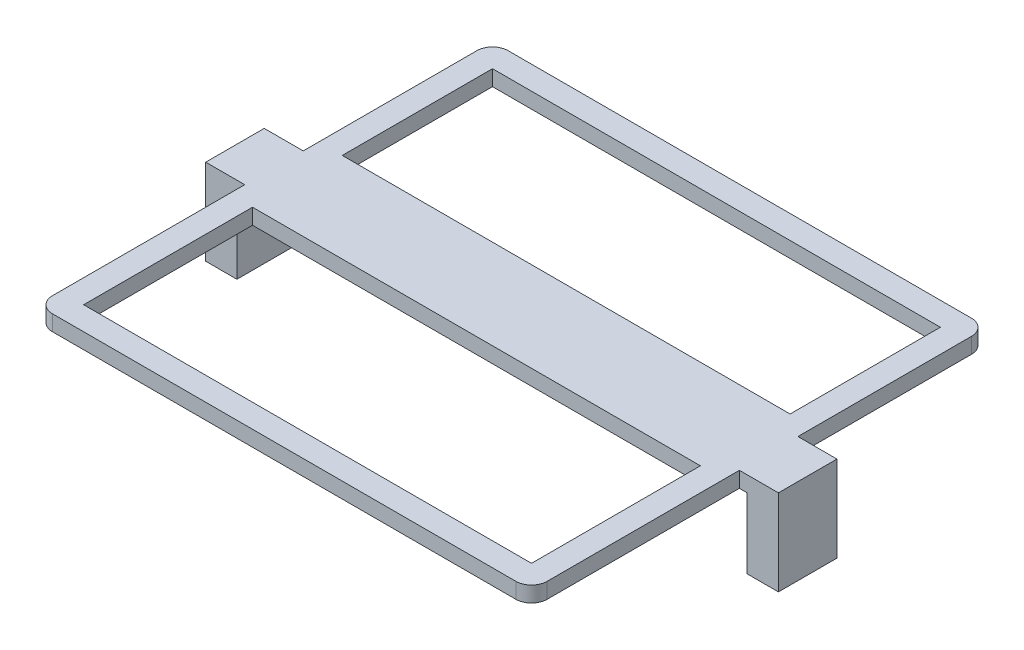
from build123d import *

# Parameters (mm, degrees)
SKETCH_1_W      = 57.4
SKETCH_1_H      = 19.255
SKETCH_1_H_2    = 21.645
EXTRUDE_1_DEPTH = 2
FILLET_1_R      = 2
SKETCH_2_W      = 4
SKETCH_2_H      = 7.5
EXTRUDE_2_DEPTH = 9


with BuildPart() as part:
    # Эскиз1 → Бобышка-Вытянуть1 (new body)
    with BuildSketch(Plane(origin=(0, 0, 0), x_dir=(1, 0, 0), z_dir=(0, 1, 0))):
        Polygon((63.4, -24.255), (68.4, -24.255), (68.4, -31.755), (63.4, -31.755), (63.4, -58.4), (0, -58.4), (0, -31.755), (-5, -31.755), (-5, -24.255), (0, -24.255), (0, 0), (63.4, 0), align=None)
        with Locations((31.7, -12.6275)):
            Rectangle(SKETCH_1_W, SKETCH_1_H, mode=Mode.SUBTRACT)
        with Locations((31.7, -44.5775)):
            Rectangle(SKETCH_1_W, SKETCH_1_H_2, mode=Mode.SUBTRACT)
    extrude(amount=EXTRUDE_1_DEPTH)

    # Скругление1
    fillet_1_edges = [part.edges().sort_by_distance(p)[0] for p in [
        (0, 1, 0),
        (63.4, 1, 0),
        (63.4, 1, 58.4),
        (0, 1, 58.4),
    ]]
    fillet(fillet_1_edges, radius=FILLET_1_R)

    # Эскиз2 → Бобышка-Вытянуть2 (add)
    with BuildSketch(Plane(origin=(0, 0, 0), x_dir=(-1, 0, 0), z_dir=(0, -1, 0))):
        with Locations((3, -28.005)):
            Rectangle(SKETCH_2_W, SKETCH_2_H)
        with Locations((-66.4, -28.005)):
            Rectangle(SKETCH_2_W, SKETCH_2_H)
    extrude(amount=EXTRUDE_2_DEPTH)


solid = part.part
